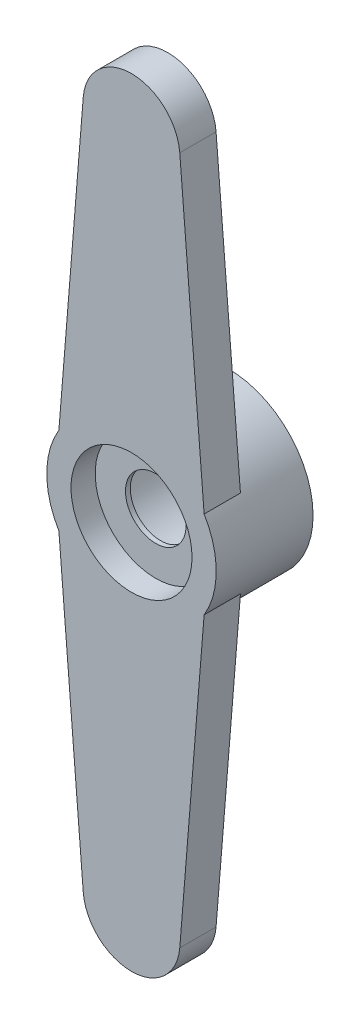
from build123d import *

# Parameters (mm, degrees)
SKETCH1_R           = 3.5
SKETCH1_R_2         = 2.5
BOSS_EXTRUDE1_DEPTH = 2.8
SKETCH2_R           = 3.5
SKETCH2_R_2         = 1.25
BOSS_EXTRUDE2_DEPTH = 0.2
SKETCH3_R           = 3.5
SKETCH3_R_2         = 2.5
BOSS_EXTRUDE3_DEPTH = 1
BOSS_EXTRUDE4_START = -1.5
BOSS_EXTRUDE4_DEPTH = 1.5


with BuildPart() as part:
    # Sketch1 → Boss-Extrude1 (new body)
    with BuildSketch(Plane.XY):
        Circle(SKETCH1_R)
        Circle(SKETCH1_R_2, mode=Mode.SUBTRACT)
    extrude(amount=BOSS_EXTRUDE1_DEPTH)

    # Sketch2 → Boss-Extrude2 (add)
    with BuildSketch(Plane.XY.offset(2.8)):
        Circle(SKETCH2_R)
        Circle(SKETCH2_R_2, mode=Mode.SUBTRACT)
    extrude(amount=BOSS_EXTRUDE2_DEPTH)

    # Sketch3 → Boss-Extrude3 (add)
    with BuildSketch(Plane.XY.offset(3)):
        Circle(SKETCH3_R)
        Circle(SKETCH3_R_2, mode=Mode.SUBTRACT)
    extrude(amount=BOSS_EXTRUDE3_DEPTH)

    # Sketch4 → Boss-Extrude4 (add)
    with BuildSketch(Plane.XY.offset(4).offset(BOSS_EXTRUDE4_START)):
        with BuildLine():
            Line((-3, -1.802775638), (-1.993465051, -14.223343039))
            ThreePointArc((-1.993465051, -14.223343039), (0, -16.061797098), (1.993465051, -14.223343039))
            Line((1.993465051, -14.223343039), (3, -1.802775638))
            ThreePointArc((3, -1.802775638), (0, -3.5), (-3, -1.802775638))
        make_face()
    boss_extrude4 = extrude(amount=BOSS_EXTRUDE4_DEPTH)

    # Mirror1: Boss-Extrude4 across plane
    add(boss_extrude4.mirror(Plane.ZX))


solid = part.part
